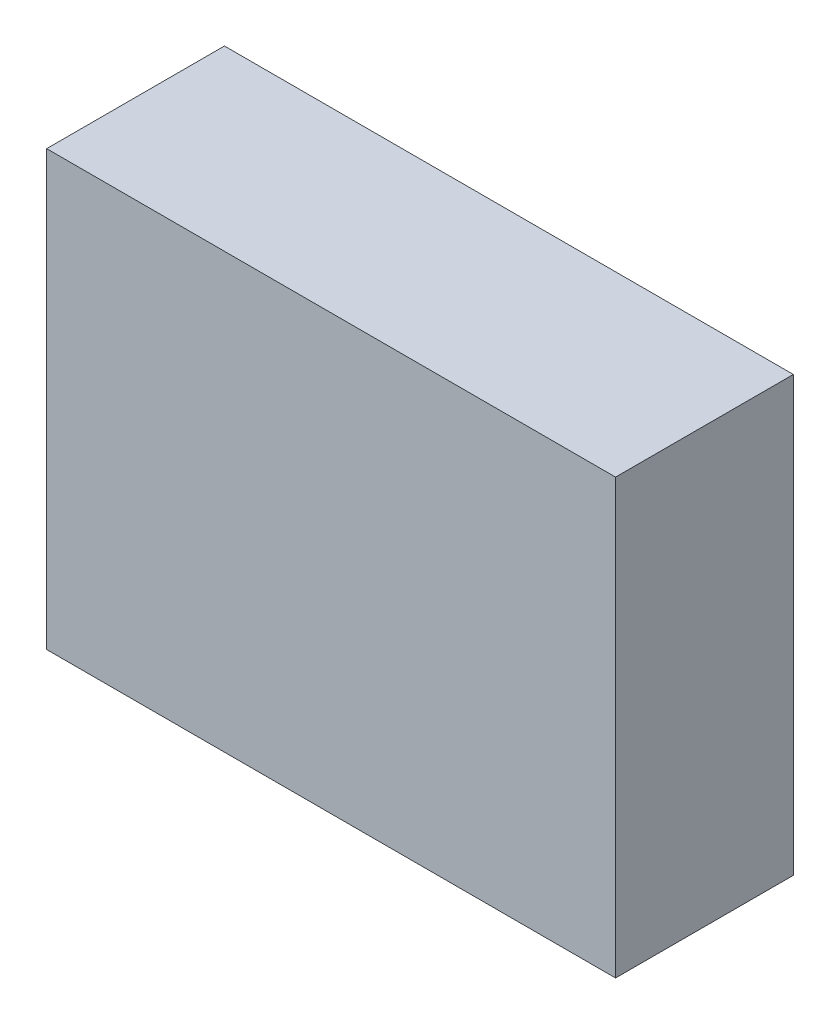
from build123d import *

# Parameters (mm, degrees)
ESBO_O1_W                = 16
ESBO_O1_H                = 12.2
RESSALTO_EXTRUS_O1_DEPTH = 5


with BuildPart() as part:
    # Esboço1 → Ressalto-extrusão1 (new body)
    with BuildSketch(Plane.XY):
        Rectangle(ESBO_O1_W, ESBO_O1_H)
    extrude(amount=RESSALTO_EXTRUS_O1_DEPTH)


solid = part.part
